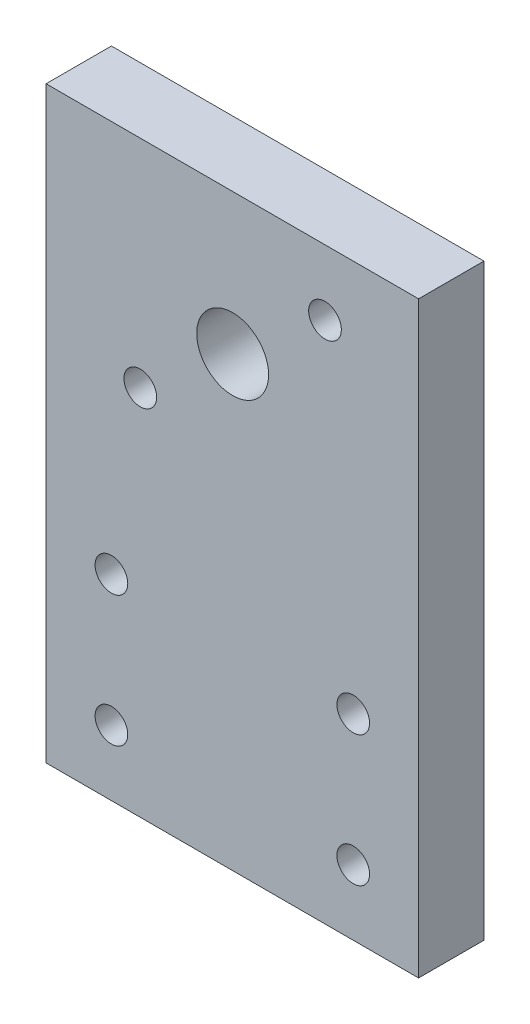
from build123d import *

# Parameters (mm, degrees)
SKETCH1_W           = 57
SKETCH1_H           = 90
BOSS_EXTRUDE1_DEPTH = 10
SKETCH2_R           = 2.5
SKETCH2_R_2         = 5.5
CUT_EXTRUDE1_DEPTH  = 10


with BuildPart() as part:
    # Sketch1 → Boss-Extrude1 (new body)
    with BuildSketch(Plane.XY):
        with Locations((28.5, 45)):
            Rectangle(SKETCH1_W, SKETCH1_H)
    extrude(amount=BOSS_EXTRUDE1_DEPTH)

    # Sketch2 → Cut-Extrude1 (cut)
    with BuildSketch(Plane.XY.offset(10)):
        with Locations((47, 30)):
            Circle(SKETCH2_R)
        with Locations((47, 10)):
            Circle(SKETCH2_R)
        with Locations((10, 10)):
            Circle(SKETCH2_R)
        with Locations((10, 30)):
            Circle(SKETCH2_R)
        with Locations((28.55, 68.45)):
            Circle(SKETCH2_R_2)
        with Locations((14.419890305, 56.9)):
            Circle(SKETCH2_R)
        with Locations((42.680109695, 80)):
            Circle(SKETCH2_R)
    extrude(amount=-CUT_EXTRUDE1_DEPTH, mode=Mode.SUBTRACT)


solid = part.part
